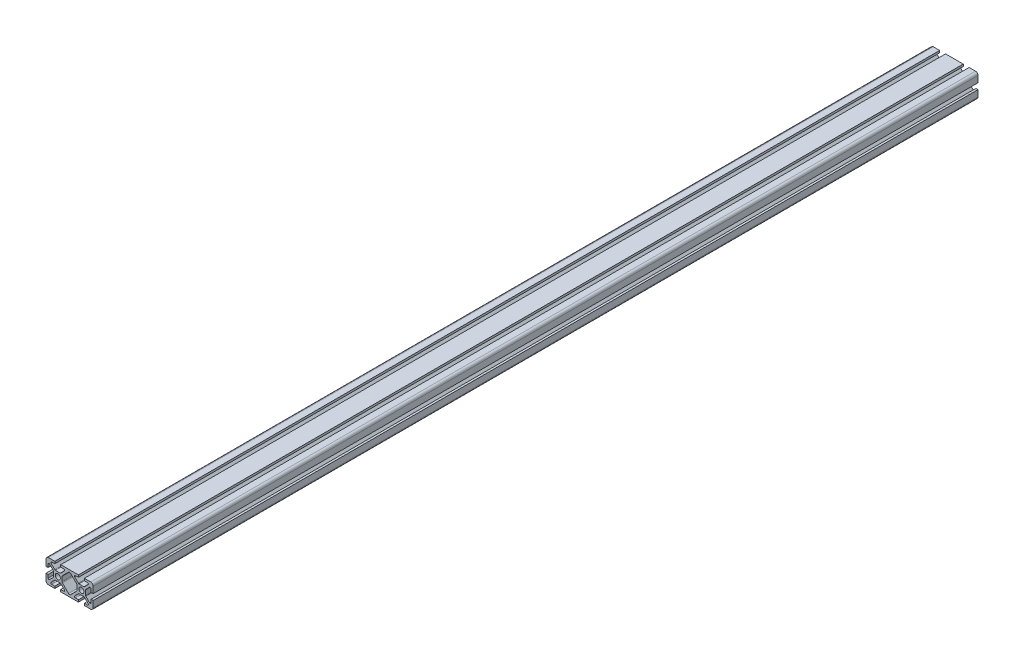
from build123d import *

# Parameters (mm, degrees)
BOSS_EXTRUDE1_DEPTH = 375
BOSS_EXTRUDE2_DEPTH = 375
FILLET1_R           = 0.75
FILLET2_R           = 1.25


with BuildPart() as part:
    # Sketch3 → Boss-Extrude1 (new, symmetric)
    with BuildSketch(Plane.XY):
        with BuildLine():
            Line((12.5, -10), (17.9, -10))
            ThreePointArc((17.9, -10), (19.38492424, -9.38492424), (20, -7.9))
            Line((20, -7.9), (20, -2.5))
            Line((20, -2.5), (18.213351365, -2.5))
            Line((18.213351365, -2.5), (18.213351365, -6.95))
            Line((18.213351365, -6.95), (13.6, -2.336648635))
            Line((13.6, -2.336648635), (13.6, 0))
            Line((13.6, 0), (12.15, 0))
            ThreePointArc((12.15, 0), (11.52027958, -1.52027958), (10, -2.15))
            Line((10, -2.15), (10, -3.6))
            Line((10, -3.6), (12.336648635, -3.6))
            Line((12.336648635, -3.6), (16.95, -8.213351365))
            Line((16.95, -8.213351365), (12.5, -8.213351365))
            Line((12.5, -8.213351365), (12.5, -10))
        make_face()
    extrude(amount=BOSS_EXTRUDE1_DEPTH, both=True)

    # Sketch4 → Boss-Extrude2 (add, symmetric)
    with BuildSketch(Plane.XY):
        with BuildLine():
            Line((10, -3.6), (7.663351365, -3.6))
            Line((7.663351365, -3.6), (3.05, -8.213351365))
            Line((3.05, -8.213351365), (7.5, -8.213351365))
            Line((7.5, -8.213351365), (7.5, -10))
            Line((7.5, -10), (0, -10))
            Line((0, -10), (0, -8.736648635))
            Line((0, -8.736648635), (6.4, -2.336648635))
            Line((6.4, -2.336648635), (6.4, 0))
            Line((6.4, 0), (7.85, 0))
            ThreePointArc((7.85, 0), (8.47972042, -1.52027958), (10, -2.15))
            Line((10, -2.15), (10, -3.6))
        make_face()
    extrude(amount=BOSS_EXTRUDE2_DEPTH, both=True)

    # Mirror1: part across plane


with BuildPart() as part_1:
    add(part.part)
    add(part.part.mirror(Plane(origin=(0, 0, 0), x_dir=(0, 0, 1), z_dir=(1, 0, 0))))

    # Mirror2: part across plane


with BuildPart() as part_2:
    add(part_1.part)
    add(part_1.part.mirror(Plane.ZX))

    # Fillet1
    fillet1_edges = [part_2.edges().sort_by_distance(p)[0] for p in [
        (18.213351365, 6.95, 0),
        (13.6, 2.336648635, 0),
        (12.336648635, 3.6, 0),
        (16.95, 8.213351365, 0),
        (3.05, 8.213351365, 0),
        (7.663351365, 3.6, 0),
        (-18.213351365, 6.95, 0),
        (-13.6, 2.336648635, 0),
        (-7.663351365, 3.6, 0),
        (-12.336648635, 3.6, 0),
        (-16.95, 8.213351365, 0),
        (-3.05, 8.213351365, 0),
        (16.95, -8.213351365, 0),
        (12.336648635, -3.6, 0),
        (13.6, -2.336648635, 0),
        (18.213351365, -6.95, 0),
        (3.05, -8.213351365, 0),
        (7.663351365, -3.6, 0),
        (-18.213351365, -6.95, 0),
        (-13.6, -2.336648635, 0),
        (-12.336648635, -3.6, 0),
        (-16.95, -8.213351365, 0),
        (-3.05, -8.213351365, 0),
        (-7.663351365, -3.6, 0),
    ]]
    fillet(fillet1_edges, radius=FILLET1_R)

    # Fillet2
    fillet2_edges = [part_2.edges().sort_by_distance(p)[0] for p in [
        (6.4, 2.336648635, 0),
        (0, 8.736648635, 0),
        (-6.4, 2.336648635, 0),
        (6.4, -2.336648635, 0),
        (-6.4, -2.336648635, 0),
        (0, -8.736648635, 0),
    ]]
    fillet(fillet2_edges, radius=FILLET2_R)


solid = part_2.part
